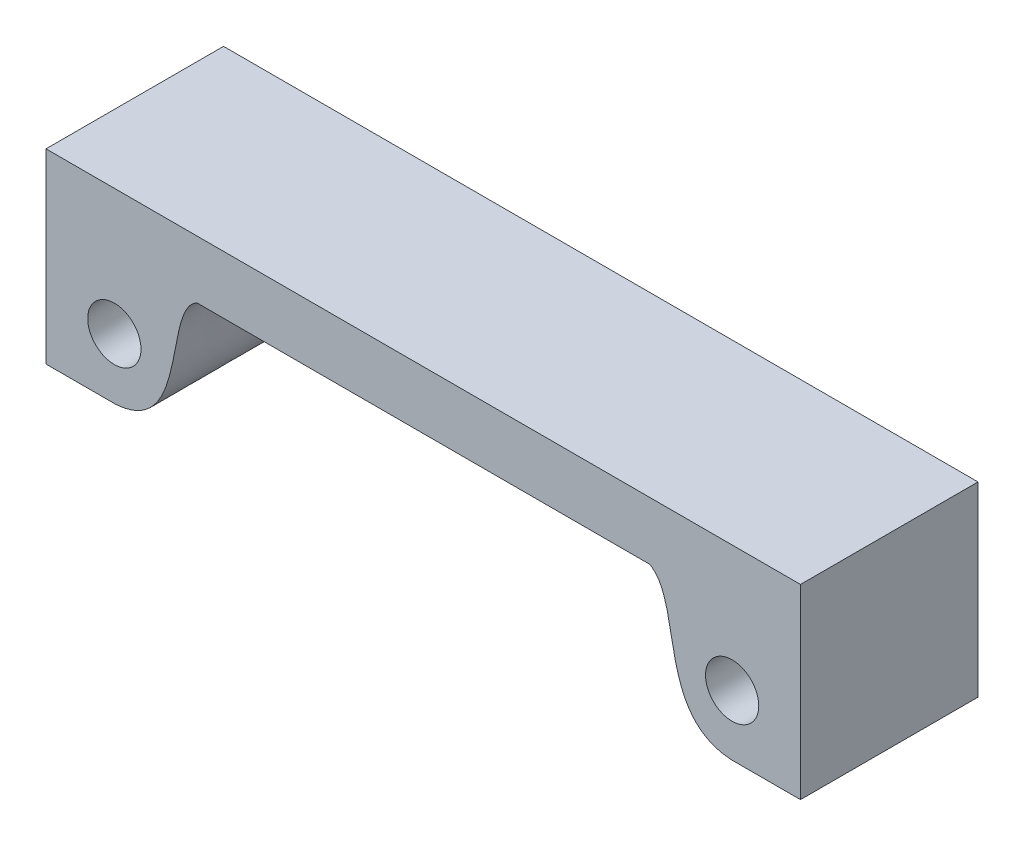
from build123d import *

# Parameters (mm, degrees)
SKETCH_3_W          = 85
SKETCH_3_H          = 21
EXTRUDE_2_DEPTH     = 20
SKETCH_4_R          = 3
CUT_EXTRUDE_2_DEPTH = 49.241579576
CUT_EXTRUDE_3_DEPTH = 49.241579576


with BuildPart() as part:
    # Эскиз3 → Вытянуть2 (new body)
    with BuildSketch(Plane.XY):
        with Locations((0, 0.5)):
            Rectangle(SKETCH_3_W, SKETCH_3_H)
    extrude(amount=EXTRUDE_2_DEPTH)

    # Эскиз4 → Вырез-Вытянуть2 (cut, through all)
    with BuildSketch(Plane.XY.offset(20)):
        with Locations((-34.8, -3.2)):
            Circle(SKETCH_4_R)
        with Locations((34.8, -3.2)):
            Circle(SKETCH_4_R)
    extrude(amount=-CUT_EXTRUDE_2_DEPTH, mode=Mode.SUBTRACT)

    # Эскиз6 → Вырез-Вытянуть3 (cut, through all)
    with BuildSketch(Plane.XY.offset(20)):
        with BuildLine():
            Line((-34.63787593, -10), (34.63787593, -10))
            add(Edge.make_bspline(
                [(25.5, 4.472396239), (29.328176933, 2.427539869), (26.262862424, -9.380662075), (34.63787593, -10)],
                knots=[0, 0, 0, 0, 1, 1, 1, 1], degree=3))
            Line((25.5, 4.472396239), (-25.5, 4.472396239))
            add(Edge.make_bspline(
                [(-25.5, 4.472396239), (-29.328176933, 2.427539869), (-26.262862424, -9.380662075), (-34.63787593, -10)],
                knots=[0, 0, 0, 0, 1, 1, 1, 1], degree=3))
        make_face()
    extrude(amount=-CUT_EXTRUDE_3_DEPTH, mode=Mode.SUBTRACT)


solid = part.part
